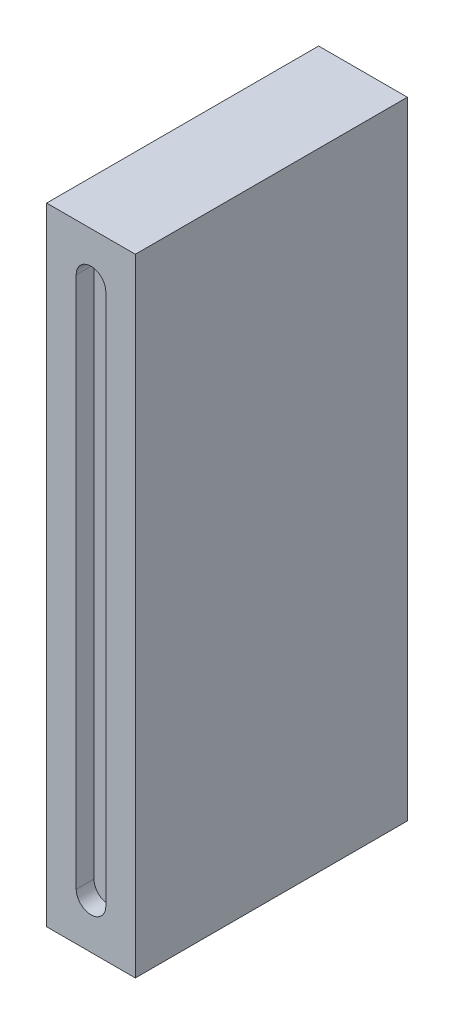
from build123d import *

# Parameters (mm, degrees)
SKETCH4_W           = 15
SKETCH4_H           = 100
BOSS_EXTRUDE1_DEPTH = 5
SKETCH5_W           = 36
SKETCH5_H           = 100
BOSS_EXTRUDE2_DEPTH = 5
CUT_EXTRUDE1_DEPTH  = 3
SKETCH7_W           = 15
SKETCH7_H           = 46
BOSS_EXTRUDE3_DEPTH = 3


with BuildPart() as part:
    # Sketch4 → Boss-Extrude1 (new body)
    with BuildSketch(Plane.XY):
        Rectangle(SKETCH4_W, SKETCH4_H)
    boss_extrude1 = extrude(amount=BOSS_EXTRUDE1_DEPTH)

    # Sketch5 → Boss-Extrude2 (add)
    with BuildSketch(Plane(origin=(7.5, 0, 0), x_dir=(0, 0, -1), z_dir=(1, 0, 0))):
        with Locations((18, 0)):
            Rectangle(SKETCH5_W, SKETCH5_H)
    extrude(amount=-BOSS_EXTRUDE2_DEPTH)

    # Mirror1: Boss-Extrude1 across plane
    add(boss_extrude1.mirror(Plane.XY.offset(-18)))

    # Sketch6 → Cut-Extrude1 (cut)
    with BuildSketch(Plane.XY.offset(5)):
        with BuildLine():
            Line((2.5, 45), (2.5, -45))
            ThreePointArc((2.5, -45), (0, -47.5), (-2.5, -45))
            Line((-2.5, -45), (-2.5, 45))
            ThreePointArc((-2.5, 45), (0, 47.5), (2.5, 45))
        make_face()
    cut_extrude1 = extrude(amount=-CUT_EXTRUDE1_DEPTH, mode=Mode.SUBTRACT)

    # Mirror2: Cut-Extrude1 across plane
    add(cut_extrude1.mirror(Plane.XY.offset(-18)), mode=Mode.SUBTRACT)

    # Sketch7 → Boss-Extrude3 (add)
    with BuildSketch(Plane.XZ.offset(50)):
        with Locations((0, -18)):
            Rectangle(SKETCH7_W, SKETCH7_H)
    boss_extrude3 = extrude(amount=BOSS_EXTRUDE3_DEPTH)

    # Mirror3: Boss-Extrude3 across plane
    add(boss_extrude3.mirror(Plane.ZX))


solid = part.part
